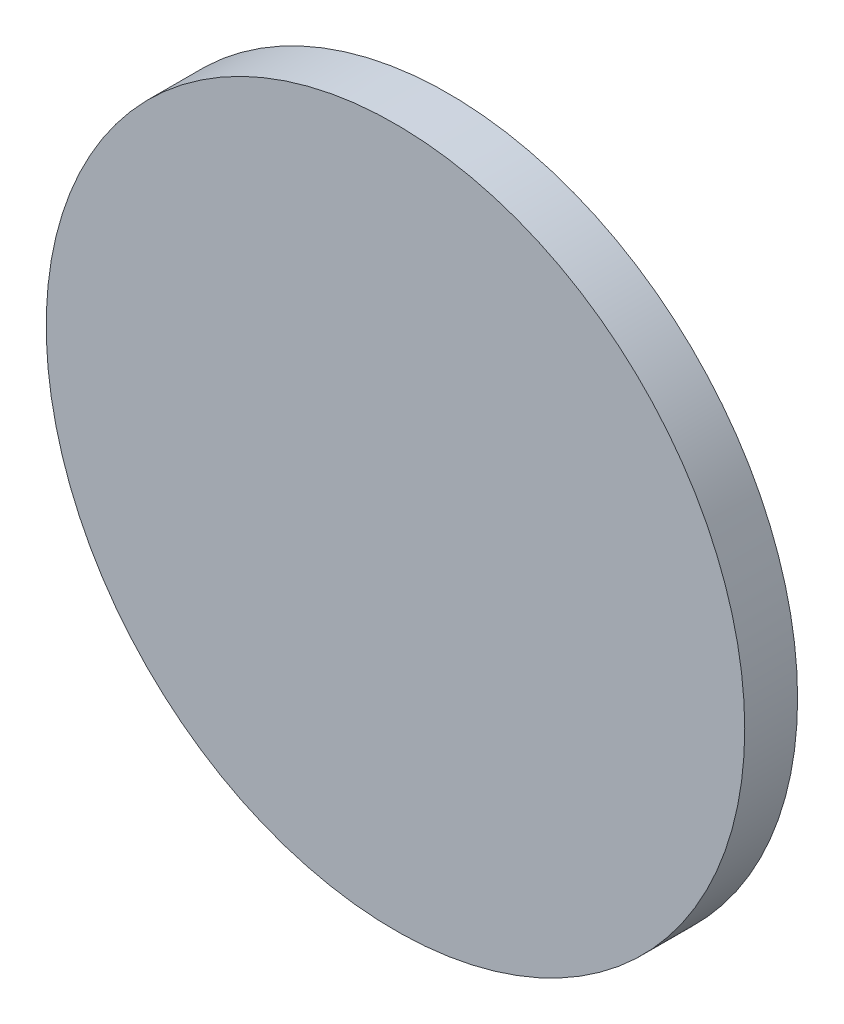
from build123d import *

# Parameters (mm, degrees)
SKETCH5_R           = 8.79
BOSS_EXTRUDE3_DEPTH = 1.33


with BuildPart() as part:
    # Sketch4 → Revolve1 (revolve)
    with BuildSketch(Plane(origin=(0, 0, 0), x_dir=(1, 0, 0), z_dir=(0, 1, 0))):
        with BuildLine():
            Line((-8.79, 1.275944095), (0, 1.275944095))
            Line((0, 1.275944095), (0, 4.150852961))
            add(Edge.make_bspline(
                [(-8.79, 1.275944095), (-4.894038476, 3.969312996), (0, 4.150852961)],
                knots=[0, 0, 0, 1, 1, 1], degree=2))
        make_face()
    revolve(axis=Axis((0, 0, -4.150852961), (0, 0, 1)))

    # Sketch5 → Boss-Extrude3 (add)
    with BuildSketch(Plane.XY.offset(-1.275944095)):
        Circle(SKETCH5_R)
    extrude(amount=BOSS_EXTRUDE3_DEPTH)


solid = part.part
